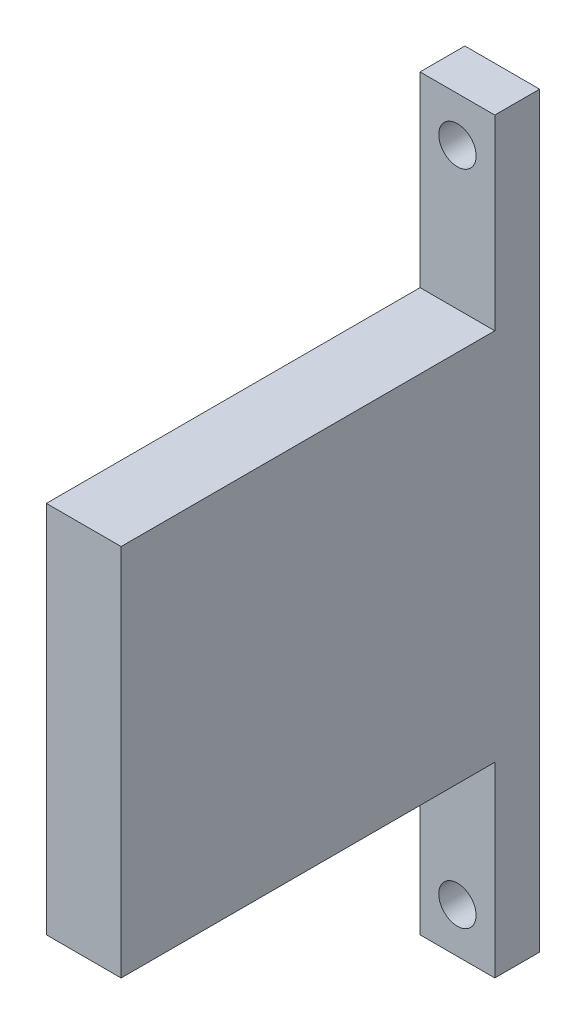
from build123d import *

# Parameters (mm, degrees)
EXTRUDE_2_DEPTH     = 5
SKETCH_2_R          = 1.25
CUT_EXTRUDE_1_DEPTH = 4
SKETCH_3_R          = 5.05
CUT_EXTRUDE_2_DEPTH = 3
CHAMFER_1_SIZE      = 0.5


with BuildPart() as part:
    # 草图1 → 凸台-拉伸2 (new body)
    with BuildSketch(Plane(origin=(0, 0, 0), x_dir=(0, 0, -1), z_dir=(1, 0, 0))):
        Polygon((25, 25), (25, 37.5), (28, 37.5), (28, -12.5), (25, -12.5), (25, 0), (0, 0), (0, 25), align=None)
    extrude(amount=EXTRUDE_2_DEPTH)

    # 草图2 → 切除-拉伸1 (cut)
    with BuildSketch(Plane.XY.offset(-25)):
        with Locations((2.5, 34.5)):
            Circle(SKETCH_2_R)
        with Locations((2.5, -9.5)):
            Circle(SKETCH_2_R)
    extrude(amount=-CUT_EXTRUDE_1_DEPTH, mode=Mode.SUBTRACT)

    # 草图3 → 切除-拉伸2 (cut)
    with BuildSketch(Plane.ZY):
        with Locations((-8, 12.5)):
            Circle(SKETCH_3_R)
    extrude(amount=-CUT_EXTRUDE_2_DEPTH, mode=Mode.SUBTRACT)

    # 倒角1
    chamfer_1_edges = [part.edges().sort_by_distance(p)[0] for p in [
        (0, 12.5, -13.05),
    ]]
    chamfer(chamfer_1_edges, length=CHAMFER_1_SIZE)


solid = part.part
